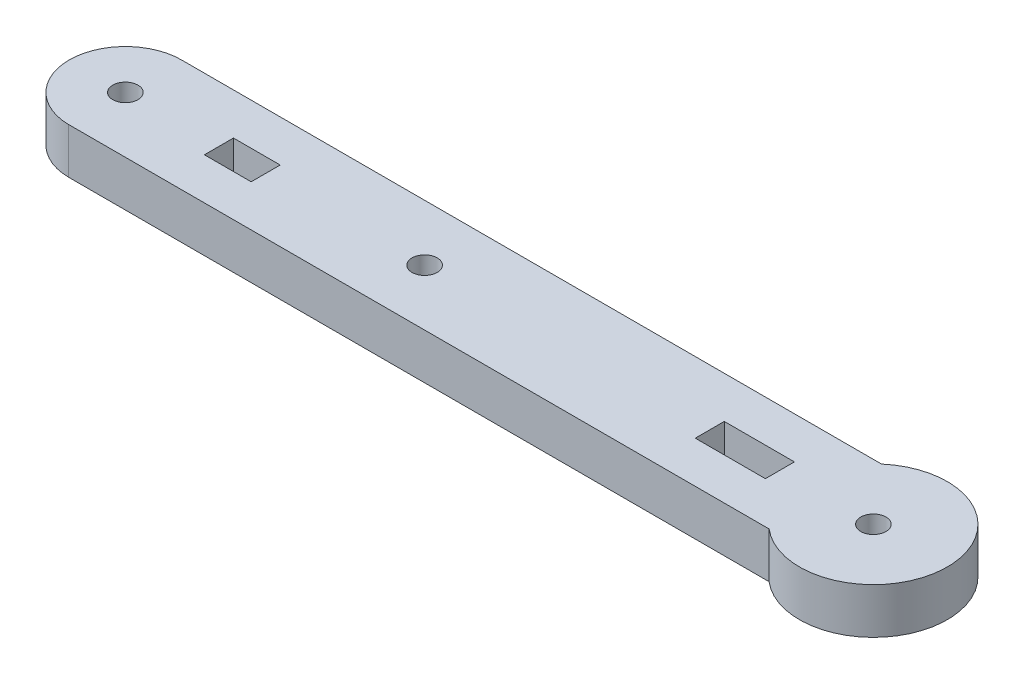
from build123d import *

# Parameters (mm, degrees)
SKETCH1_R           = 0.8763
SKETCH1_W           = 4.871922601
SKETCH1_H           = 2.01733498
BOSS_EXTRUDE1_DEPTH = 3.175


with BuildPart() as part:
    # Sketch1 → Boss-Extrude1 (new body)
    with BuildSketch(Plane(origin=(0, 0, 0), x_dir=(1, 0, 0), z_dir=(0, 1, 0))):
        with BuildLine():
            Line((19.886382458, -3.437122558), (-28.789940164, -3.436792079))
            ThreePointArc((-28.789940164, -3.436792079), (-32.647020001, 0.491263054), (-28.742479365, 4.372144967))
            Line((-28.742479365, 4.372144967), (19.886338504, 4.372144967))
            ThreePointArc((19.886338504, 4.372144967), (28.36848968, 0.467558945), (19.886382458, -3.437122558))
        make_face()
        with Locations(Location((-28.742479365, 0.467532217, 0), (0, 0, 270))):
            Circle(SKETCH1_R, mode=Mode.SUBTRACT)
        with Locations(Location((-7.951646395, 0.467466465, 0), (0, 0, 270))):
            Circle(SKETCH1_R, mode=Mode.SUBTRACT)
        with Locations(Location((23.228702339, 0.467530016, 0), (0, 0, 270))):
            Circle(SKETCH1_R, mode=Mode.SUBTRACT)
        Polygon((-22.242501784, 1.443620076), (-22.242501784, 1.476197509), (-18.994538581, 1.476197509), (-18.994538581, 1.443620076), (-18.994538581, -0.508687146), (-18.994538581, -0.541137472), (-22.242501784, -0.541137472), (-22.242501784, -0.508687146), align=None, mode=Mode.SUBTRACT)
        with Locations((14.296879657, 0.467530017)):
            Rectangle(SKETCH1_W, SKETCH1_H, mode=Mode.SUBTRACT)
    extrude(amount=BOSS_EXTRUDE1_DEPTH)


solid = part.part
